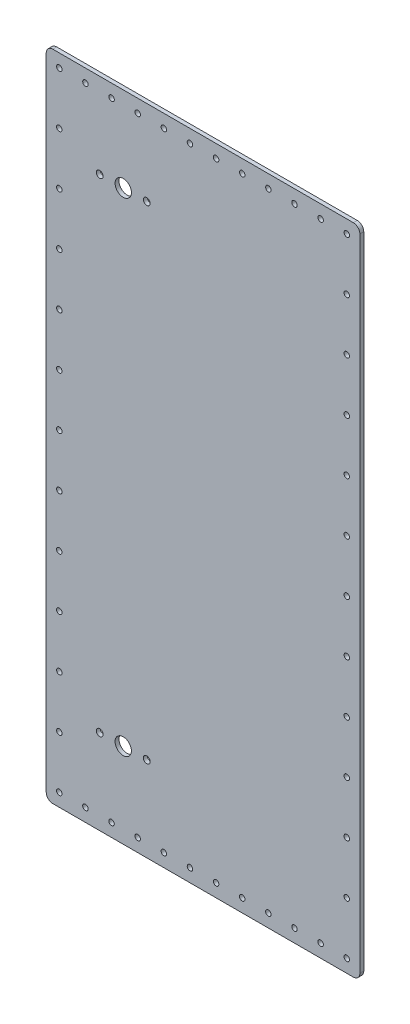
from build123d import *

# Parameters (mm, degrees)
SKETCH1_W           = 240
SKETCH1_H           = 500
BOSS_EXTRUDE1_DEPTH = 3
SKETCH2_R           = 2.1
CUT_EXTRUDE1_DEPTH  = 278.324719418
SKETCH3_R           = 2.1
CUT_EXTRUDE2_DEPTH  = 278.324719418
SKETCH4_R           = 2.6
SKETCH4_R_2         = 6.25
CUT_EXTRUDE3_DEPTH  = 278.324719418
FILLET1_R           = 5


with BuildPart() as part:
    # Sketch1 → Boss-Extrude1 (new body)
    with BuildSketch(Plane.XY):
        Rectangle(SKETCH1_W, SKETCH1_H)
    extrude(amount=BOSS_EXTRUDE1_DEPTH)

    # Sketch2 → Cut-Extrude1 (cut, through all)
    with BuildSketch(Plane.XY.offset(3)):
        with Locations((-110, 240)):
            Circle(SKETCH2_R)
        with Locations((-110, 200)):
            Circle(SKETCH2_R)
        with Locations((-110, 160)):
            Circle(SKETCH2_R)
        with Locations((-110, 120)):
            Circle(SKETCH2_R)
        with Locations((-110, 80)):
            Circle(SKETCH2_R)
        with Locations((-110, 40)):
            Circle(SKETCH2_R)
        with Locations((-110, 0)):
            Circle(SKETCH2_R)
        with Locations((-110, -40)):
            Circle(SKETCH2_R)
        with Locations((-110, -80)):
            Circle(SKETCH2_R)
        with Locations((-110, -120)):
            Circle(SKETCH2_R)
        with Locations((-110, -160)):
            Circle(SKETCH2_R)
        with Locations((-110, -200)):
            Circle(SKETCH2_R)
    cut_extrude1 = extrude(amount=-CUT_EXTRUDE1_DEPTH, mode=Mode.SUBTRACT)

    # Sketch3 → Cut-Extrude2 (cut, through all)
    with BuildSketch(Plane(origin=(0, 0, 0), x_dir=(-1, 0, 0), z_dir=(0, 0, -1))):
        with Locations((90, 240)):
            Circle(SKETCH3_R)
        with Locations((70, 240)):
            Circle(SKETCH3_R)
        with Locations((50, 240)):
            Circle(SKETCH3_R)
        with Locations((30, 240)):
            Circle(SKETCH3_R)
        with Locations((10, 240)):
            Circle(SKETCH3_R)
        with Locations((-10, 240)):
            Circle(SKETCH3_R)
        with Locations((-30, 240)):
            Circle(SKETCH3_R)
        with Locations((-50, 240)):
            Circle(SKETCH3_R)
        with Locations((-70, 240)):
            Circle(SKETCH3_R)
        with Locations((-90, 240)):
            Circle(SKETCH3_R)
        with Locations((-110, 240)):
            Circle(SKETCH3_R)
    cut_extrude2 = extrude(amount=-CUT_EXTRUDE2_DEPTH, mode=Mode.SUBTRACT)

    # Mirror1: Cut-Extrude1 across plane
    add(cut_extrude1.mirror(Plane(origin=(0, 0, 0), x_dir=(0, 0, 1), z_dir=(1, 0, 0))), mode=Mode.SUBTRACT)

    # Mirror2: Cut-Extrude1, Cut-Extrude2 across plane
    add(cut_extrude1.mirror(Plane.ZX), mode=Mode.SUBTRACT)
    add(cut_extrude2.mirror(Plane.ZX), mode=Mode.SUBTRACT)

    # Sketch4 → Cut-Extrude3 (cut, through all)
    with BuildSketch(Plane.XY.offset(3)):
        with Locations((-43.069851171, -185)):
            Circle(SKETCH4_R)
        with Locations((-79.069851171, -185)):
            Circle(SKETCH4_R)
        with Locations((-61.069851171, -184.999999989)):
            Circle(SKETCH4_R_2)
        with Locations(Location((-61.069851171, 184.999999989, 0), (0, 0, 180))):
            Circle(SKETCH4_R_2)
        with Locations(Location((-79.069851171, 185, 0), (0, 0, 180))):
            Circle(SKETCH4_R)
        with Locations(Location((-43.069851171, 185, 0), (0, 0, 180))):
            Circle(SKETCH4_R)
    extrude(amount=-CUT_EXTRUDE3_DEPTH, mode=Mode.SUBTRACT)

    # Fillet1
    fillet1_edges = [part.edges().sort_by_distance(p)[0] for p in [
        (120, -250, 1.5),
        (-120, -250, 1.5),
        (-120, 250, 1.5),
        (120, 250, 1.5),
    ]]
    fillet(fillet1_edges, radius=FILLET1_R)


solid = part.part
